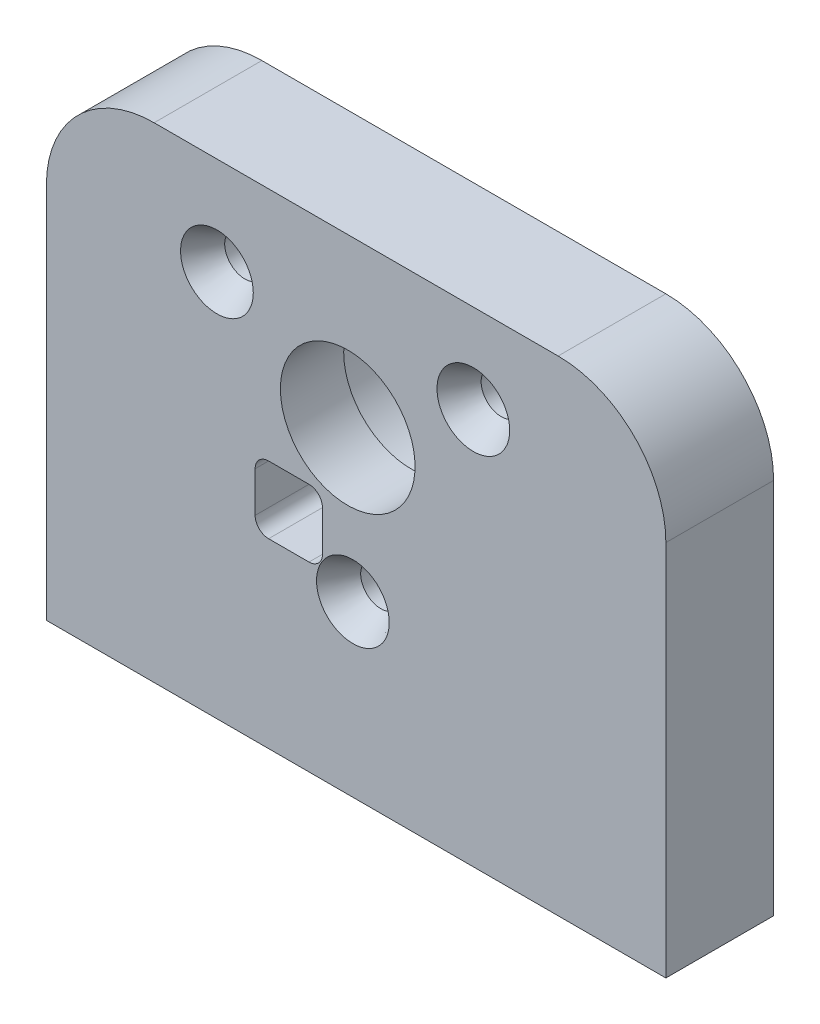
from build123d import *

# Parameters (mm, degrees)
SKETCH1_W                     = 46
SKETCH1_H                     = 36
BOSS_EXTRUDE1_DEPTH           = 8
M3X0_5_TAPPED_HOLE1_D         = 2.5
M3X0_5_TAPPED_HOLE1_DEPTH     = 7.5
M3X0_5_TAPPED_HOLE1_TIP       = 0.751075774
M3X0_5_TAPPED_HOLE2_D         = 2.5
M3X0_5_TAPPED_HOLE2_DEPTH     = 7.5
M3X0_5_TAPPED_HOLE2_TIP       = 0.751075774
FILLET2_R                     = 8
SKETCH13_W                    = 5
SKETCH13_H                    = 5
CUT_EXTRUDE1_DEPTH            = 4.5
CSK_FOR_M3_SFHCS1_D           = 3
CSK_FOR_M3_SFHCS1_DEPTH       = 9.5
CSK_FOR_M3_SFHCS1_CSINK_D     = 5.3
CSK_FOR_M3_SFHCS1_CSINK_ANGLE = 60
CSK_FOR_M3_SFHCS1_TIP         = 0.901290929
FILLET3_R                     = 1
HOLE1_D                       = 10
HOLE1_CBORE_D                 = 12
HOLE1_CBORE_DEPTH             = 3.3
CSK_FOR_M3_SFHCS2_D           = 3
CSK_FOR_M3_SFHCS2_DEPTH       = 9.5
CSK_FOR_M3_SFHCS2_CSINK_D     = 5.4
CSK_FOR_M3_SFHCS2_CSINK_ANGLE = 60
CSK_FOR_M3_SFHCS2_TIP         = 0.901290929


with BuildPart() as part:
    # Sketch1 → Boss-Extrude1 (new body)
    with BuildSketch(Plane.XY.offset(4.5)):
        Rectangle(SKETCH1_W, SKETCH1_H)
    extrude(amount=-BOSS_EXTRUDE1_DEPTH)

    # M3x0.5 Tapped Hole1
    with Locations(Plane(origin=(0, -18, 0), x_dir=(-1, 0, 0), z_dir=(0, -1, 0))):
        with Locations((0, -0.5)):
            Hole(M3X0_5_TAPPED_HOLE1_D / 2, depth=M3X0_5_TAPPED_HOLE1_DEPTH)
            with Locations((0, 0, -(M3X0_5_TAPPED_HOLE1_DEPTH + M3X0_5_TAPPED_HOLE1_TIP / 2))):  # 118° drill point
                Cone(0, M3X0_5_TAPPED_HOLE1_D / 2, M3X0_5_TAPPED_HOLE1_TIP, mode=Mode.SUBTRACT)

    # M3x0.5 Tapped Hole2
    with Locations(Plane(origin=(0, -18, 0), x_dir=(-1, 0, 0), z_dir=(0, -1, 0))):
        with Locations((-19, -0.5), (19, -0.5)):
            Hole(M3X0_5_TAPPED_HOLE2_D / 2, depth=M3X0_5_TAPPED_HOLE2_DEPTH)
            with Locations((0, 0, -(M3X0_5_TAPPED_HOLE2_DEPTH + M3X0_5_TAPPED_HOLE2_TIP / 2))):  # 118° drill point
                Cone(0, M3X0_5_TAPPED_HOLE2_D / 2, M3X0_5_TAPPED_HOLE2_TIP, mode=Mode.SUBTRACT)

    # Fillet2
    fillet2_edges = [part.edges().sort_by_distance(p)[0] for p in [
        (-23, 18, 0.5),
        (23, 18, 0.5),
    ]]
    fillet(fillet2_edges, radius=FILLET2_R)

    # Sketch13 → Cut-Extrude1 (cut)
    with BuildSketch(Plane.XY.offset(4.5)):
        with Locations((-5, -2)):
            Rectangle(SKETCH13_W, SKETCH13_H)
    extrude(amount=-CUT_EXTRUDE1_DEPTH, mode=Mode.SUBTRACT)

    # CSK for M3 SFHCS1
    with Locations(Plane(origin=(-5, -2, -3.5), x_dir=(-1, 0, 0), z_dir=(0, 0, -1))):
        with Locations((0, 0)):
            CounterSinkHole(CSK_FOR_M3_SFHCS1_D / 2, CSK_FOR_M3_SFHCS1_CSINK_D / 2, depth=CSK_FOR_M3_SFHCS1_DEPTH, counter_sink_angle=CSK_FOR_M3_SFHCS1_CSINK_ANGLE)
            with Locations((0, 0, -(CSK_FOR_M3_SFHCS1_DEPTH + CSK_FOR_M3_SFHCS1_TIP / 2))):  # 118° drill point
                Cone(0, CSK_FOR_M3_SFHCS1_D / 2, CSK_FOR_M3_SFHCS1_TIP, mode=Mode.SUBTRACT)

    # Fillet3
    fillet3_edges = [part.edges().sort_by_distance(p)[0] for p in [
        (-2.5, 0.5, 2.25),
        (-2.5, -4.5, 2.25),
        (-7.5, -4.5, 2.25),
        (-7.5, 0.5, 2.25),
    ]]
    fillet(fillet3_edges, radius=FILLET3_R)

    # Hole1 (through all)
    with Locations(Plane(origin=(0, 0, -3.5), x_dir=(-1, 0, 0), z_dir=(0, 0, -1))):
        with Locations((0.625, 5.577722283)):
            CounterBoreHole(HOLE1_D / 2, HOLE1_CBORE_D / 2, HOLE1_CBORE_DEPTH)

    # CSK for M3 SFHCS2
    with Locations(Plane.XY.offset(4.5)):
        with Locations((-10.337423522, 10.741909474), (8.703529058, 11.40683419), (-0.241105536, -5.415576815)):
            CounterSinkHole(CSK_FOR_M3_SFHCS2_D / 2, CSK_FOR_M3_SFHCS2_CSINK_D / 2, depth=CSK_FOR_M3_SFHCS2_DEPTH, counter_sink_angle=CSK_FOR_M3_SFHCS2_CSINK_ANGLE)
            with Locations((0, 0, -(CSK_FOR_M3_SFHCS2_DEPTH + CSK_FOR_M3_SFHCS2_TIP / 2))):  # 118° drill point
                Cone(0, CSK_FOR_M3_SFHCS2_D / 2, CSK_FOR_M3_SFHCS2_TIP, mode=Mode.SUBTRACT)


solid = part.part
